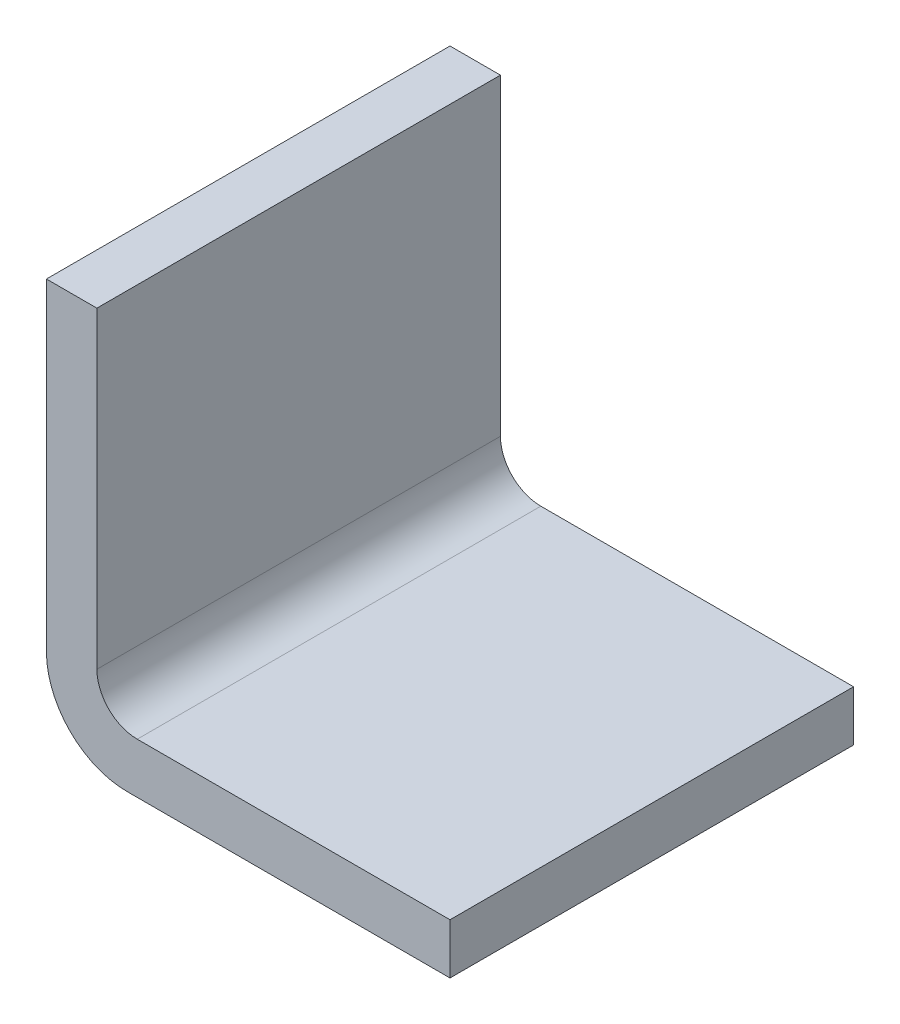
from build123d import *

# Parameters (mm, degrees)
BOSS_EXTRUDE1_DEPTH = 12.7


with BuildPart() as part:
    # Sketch1 → Boss-Extrude1 (new body)
    with BuildSketch(Plane.XY):
        with BuildLine():
            Line((2.54, 0), (12.7, 0))
            Line((12.7, 0), (12.7, 1.5875))
            Line((12.7, 1.5875), (2.8575, 1.5875))
            ThreePointArc((2.8575, 1.5875), (1.959474388, 1.959474388), (1.5875, 2.8575))
            Line((1.5875, 2.8575), (1.5875, 12.7))
            Line((1.5875, 12.7), (0, 12.7))
            Line((0, 12.7), (0, 2.54))
            ThreePointArc((0, 2.54), (0.743948776, 0.743948776), (2.54, 0))
        make_face()
    extrude(amount=BOSS_EXTRUDE1_DEPTH)


solid = part.part
